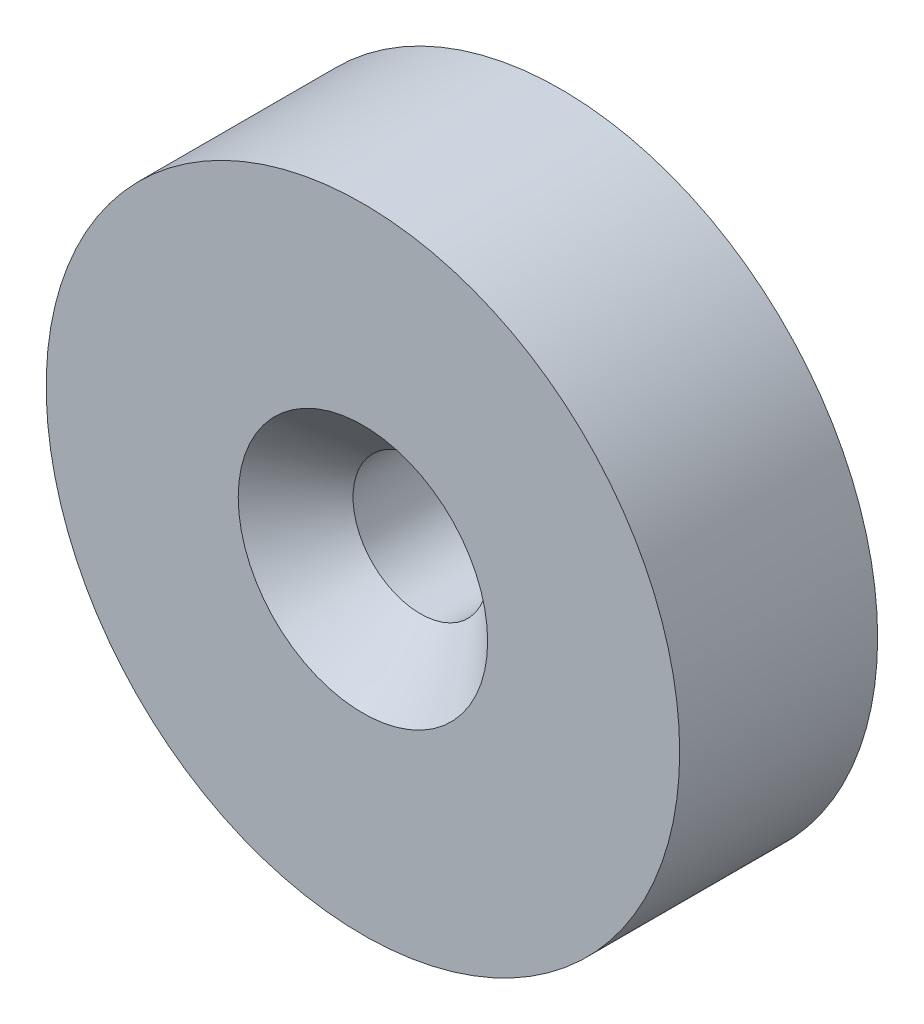
from build123d import *

# Parameters (mm, degrees)
SKETCH_1_R                   = 8
EXTRUDE_1_DEPTH              = 5
HOLE_WIZARD_M3_2_D           = 3.4
HOLE_WIZARD_M3_2_CSINK_D     = 6.3
HOLE_WIZARD_M3_2_CSINK_ANGLE = 90


with BuildPart() as part:
    # ｽｹｯﾁ1 → ﾎﾞｽ - 押し出し1 (new body)
    with BuildSketch(Plane.XY):
        Circle(SKETCH_1_R)
    extrude(amount=EXTRUDE_1_DEPTH)

    # M3 丸皿ねじ用皿穴2 (through all)
    with Locations(Plane.XY.offset(5)):
        with Locations((0, 0)):
            CounterSinkHole(HOLE_WIZARD_M3_2_D / 2, HOLE_WIZARD_M3_2_CSINK_D / 2, counter_sink_angle=HOLE_WIZARD_M3_2_CSINK_ANGLE)


solid = part.part
